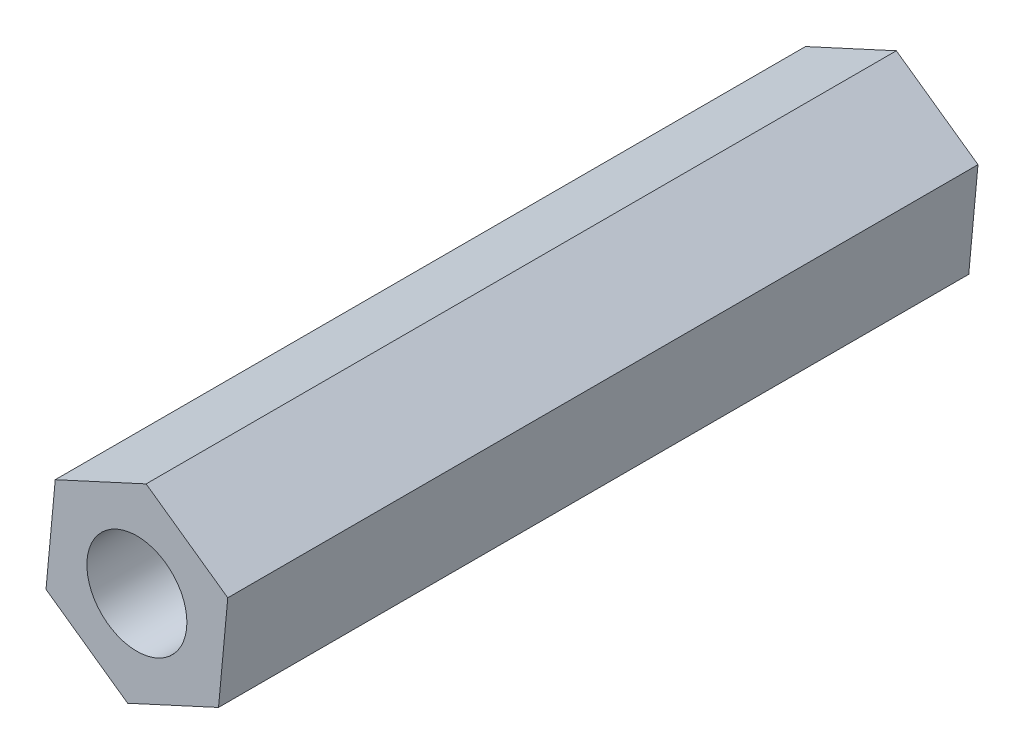
from build123d import *

# Parameters (mm, degrees)
SKETCH1_R           = 2
BOSS_EXTRUDE1_DEPTH = 30


with BuildPart() as part:
    # Sketch1 → Boss-Extrude1 (new body)
    with BuildSketch(Plane.XY):
        Polygon((-0.323243476, -120.629438838), (-0.693038362, -124.612308625), (2.571330611, -126.923995284), (6.20549447, -125.252812156), (6.575289356, -121.269942369), (3.310920383, -118.95825571), align=None)
        with Locations((2.941125497, -122.941125497)):
            Circle(SKETCH1_R, mode=Mode.SUBTRACT)
    extrude(amount=BOSS_EXTRUDE1_DEPTH)


solid = part.part
